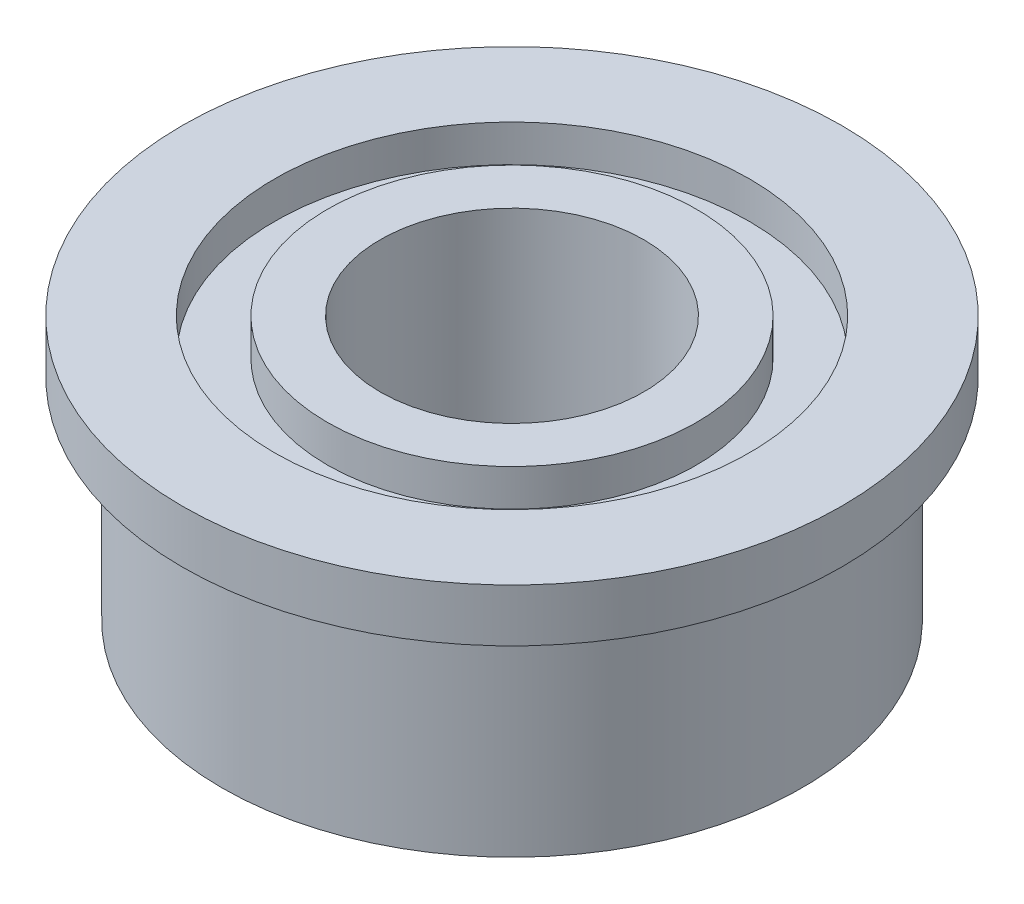
from build123d import *

# Parameters (mm, degrees)
SKETCH_2_R      = 6.25
SKETCH_2_R_2    = 5.5
EXTRUDE_1_DEPTH = 1


with BuildPart() as part:
    # 草图1 → 旋转1 (revolve)
    with BuildSketch(Plane.XY, mode=Mode.PRIVATE) as revolve_1_sk:
        Polygon((2.5, 5), (2.5, 0), (3.5, 0), (3.5, 0.7), (4.5, 0.7), (4.5, 0), (5.5, 0), (5.5, 5), (4.5, 5), (4.5, 4.3), (3.5, 4.3), (3.5, 5), align=None)
    revolve(revolve_1_sk.sketch.rotate(Axis((0, 4.611296038, 0), (0, -1, 0)), 90), axis=Axis((0, 4.611296038, 0), (0, -1, 0)))

    # 草图2 → 凸台-拉伸1 (add)
    with BuildSketch(Plane(origin=(0, 5, 0), x_dir=(1, 0, 0), z_dir=(0, 1, 0))):
        with Locations(Location((0, 0, 0), (0, 0, 270))):
            Circle(SKETCH_2_R)
        with Locations(Location((0, 0, 0), (0, 0, 270))):
            Circle(SKETCH_2_R_2, mode=Mode.SUBTRACT)
    extrude(amount=-EXTRUDE_1_DEPTH)


solid = part.part
